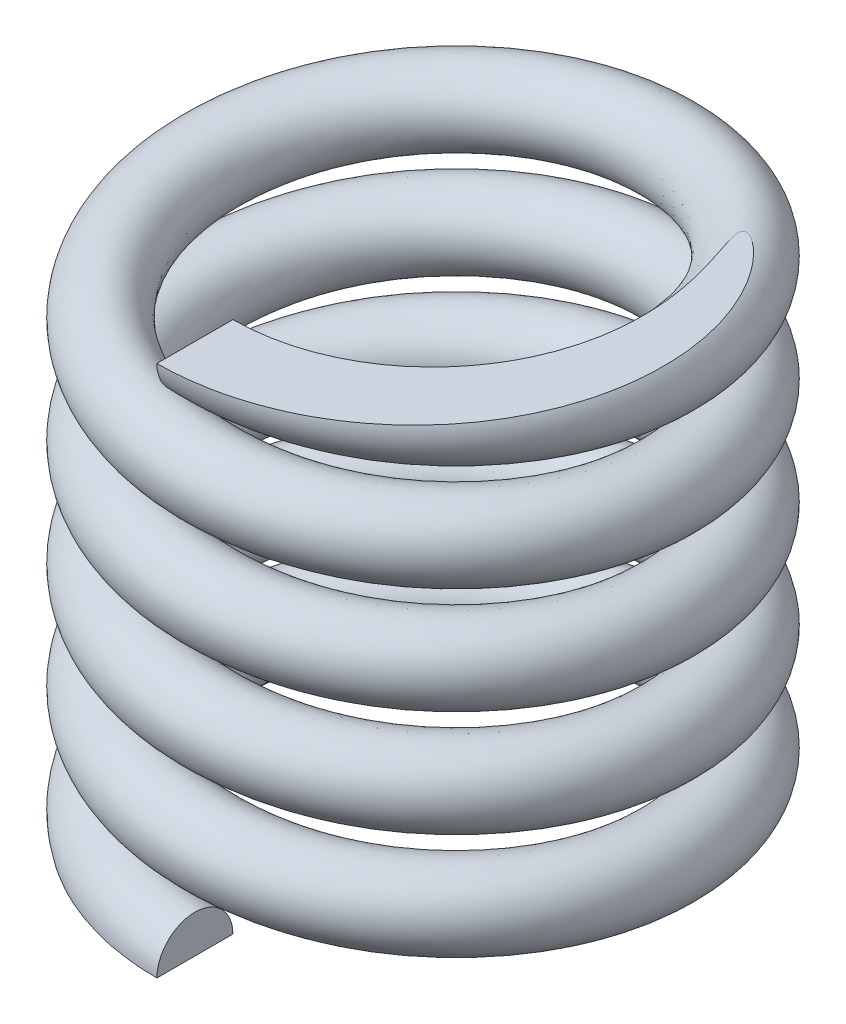
from build123d import *

# Parameters (mm, degrees)
SWEEP1_PITCH       = 1.4
SWEEP1_HEIGHT      = 7
SWEEP1_RADIUS      = 3
SKETCH2_R          = 0.5
SKETCH3_W          = 8.214228416
SKETCH3_H          = 0.5
CUT_EXTRUDE1_DEPTH = 5


with BuildPart() as part:
    # Sweep1: sweep along a helix
    with BuildLine() as sweep1_path:
        Helix(SWEEP1_PITCH, SWEEP1_HEIGHT, SWEEP1_RADIUS, center=(0, 0, 0), direction=(0, 1, 0), lefthand=True)
    # Sketch2 → Sweep1 (sweep)
    with BuildSketch(Plane(origin=(0, 0, 0), x_dir=(0, 0, -1), z_dir=(1, 0, 0))):
        with Locations((-3, 0)):
            Circle(SKETCH2_R)
    sweep(path=sweep1_path.line, is_frenet=True)

    # Sketch3 → Cut-Extrude1 (cut, symmetric)
    with BuildSketch(Plane(origin=(0, 0, 0), x_dir=(0, 0, -1), z_dir=(1, 0, 0))):
        with Locations((0.311222319, -0.25)):
            Rectangle(SKETCH3_W, SKETCH3_H)
        with Locations((0.311222319, 7.25)):
            Rectangle(SKETCH3_W, SKETCH3_H)
    extrude(amount=CUT_EXTRUDE1_DEPTH, both=True, mode=Mode.SUBTRACT)


solid = part.part
